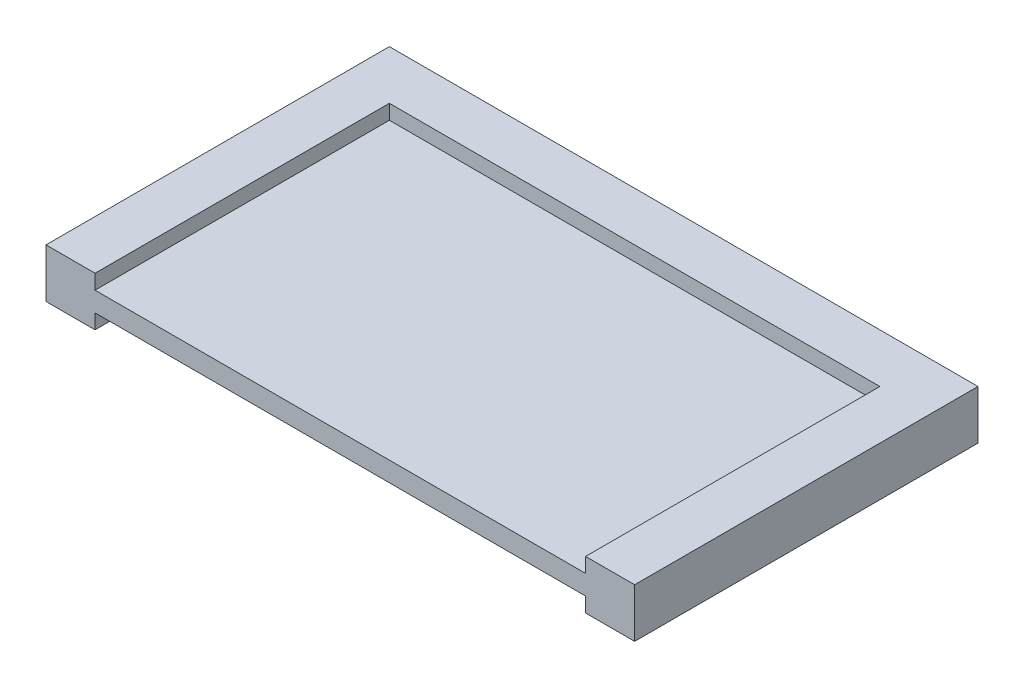
from build123d import *

# Parameters (mm, degrees)
BOSS_EXTRUDE1_DEPTH = 1.5875
SKETCH2_W           = 31.75
SKETCH2_H           = 19.05
BOSS_EXTRUDE2_DEPTH = 0.635


with BuildPart() as part:
    # Sketch1 → Boss-Extrude1 (new, symmetric)
    with BuildSketch(Plane(origin=(0, 0, 0), x_dir=(1, 0, 0), z_dir=(0, 1, 0))):
        Polygon((-19.05, 0), (-15.875, 0), (-15.875, 19.05), (15.875, 19.05), (15.875, 0), (19.05, 0), (19.05, 22.225), (-19.05, 22.225), align=None)
    extrude(amount=BOSS_EXTRUDE1_DEPTH, both=True)

    # Sketch2 → Boss-Extrude2 (add, symmetric)
    with BuildSketch(Plane(origin=(0, 0, 0), x_dir=(1, 0, 0), z_dir=(0, 1, 0))):
        with Locations((0, 9.525)):
            Rectangle(SKETCH2_W, SKETCH2_H)
    extrude(amount=BOSS_EXTRUDE2_DEPTH, both=True)


solid = part.part
